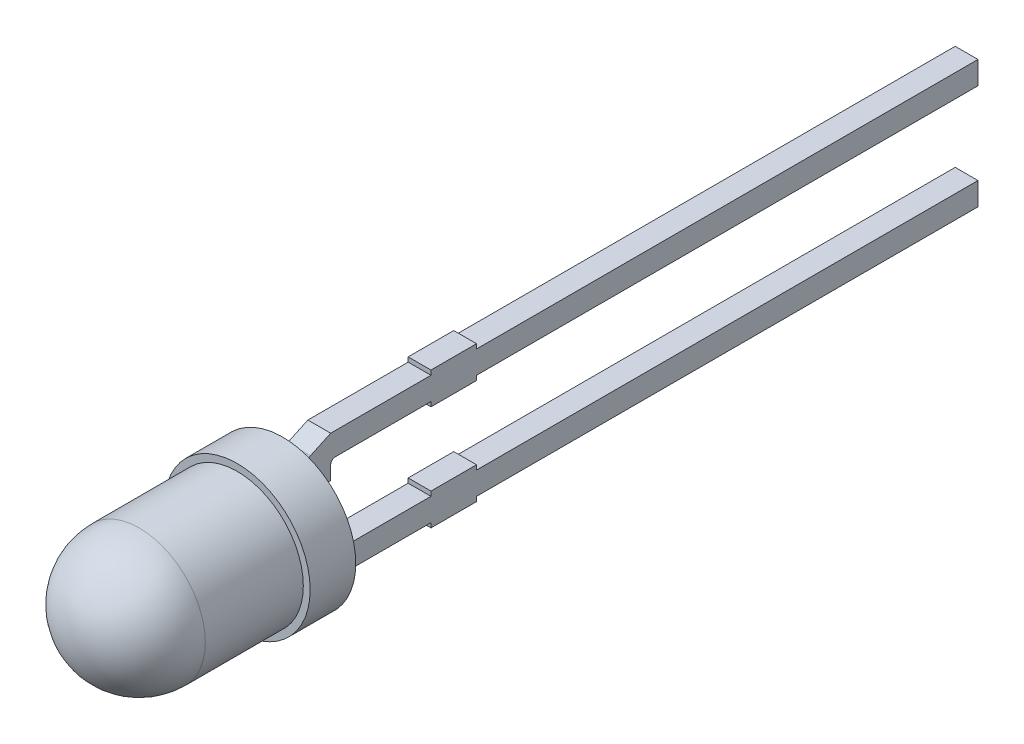
from build123d import *

# Parameters (mm, degrees)
EXTRUDE1_DEPTH          = 0.25
FILLET1_R               = 0.25
CUT_EXTRUDE1_DEPTH      = 31.234789562
CUT_EXTRUDE1_DEPTH_BACK = 31.234789562
SKETCH3_W               = 12
SKETCH3_H               = 2.8


with BuildPart() as part:
    # Sketch1 → Revolve1 (revolve)
    with BuildSketch(Plane(origin=(0, 0, 0), x_dir=(0, 0, -1), z_dir=(1, 0, 0)), mode=Mode.PRIVATE) as revolve1_sk:
        with BuildLine():
            Line((0, 1.45), (2.15, 1.45))
            Line((2.15, 1.45), (2.15, 1.599999975))
            Line((2.15, 1.599999975), (3.15, 1.599999975))
            Line((3.15, 1.599999975), (3.15, 0))
            Line((3.15, 0), (-1.45, 0))
            ThreePointArc((-1.45, 0), (-1.025304833, 1.025304833), (0, 1.45))
        make_face()
    revolve(revolve1_sk.sketch.rotate(Axis((0, 0, 0), (0, 0, -1)), 90), axis=Axis((0, 0, 0), (0, 0, -1)))

    # Sketch2 → Extrude1 (add, symmetric)
    with BuildSketch(Plane(origin=(0, 0, 0), x_dir=(0, 0, -1), z_dir=(1, 0, 0))):
        with BuildLine():
            Line((3.15, 1.026953873), (3.95, 1.4))
            Line((3.95, 1.4), (6.15, 1.4))
            Line((6.15, 1.4), (6.15, 1.5))
            Line((6.15, 1.5), (7.15, 1.5))
            Line((7.15, 1.5), (7.15, 1.4))
            Line((7.15, 1.4), (30.15, 1.4))
            Line((30.15, 1.4), (30.15, 0.9))
            Line((30.15, 0.9), (7.15, 0.9))
            Line((7.15, 0.9), (7.15, 0.8))
            Line((7.15, 0.8), (6.15, 0.8))
            Line((6.15, 0.8), (6.15, 0.9))
            Line((6.15, 0.9), (4.05, 0.9))
            ThreePointArc((4.05, 0.9), (3.979289322, 0.870710678), (3.95, 0.8))
            Line((3.95, 0.8), (3.95, 0.5))
            Line((3.95, 0.5), (3.15, 0.5))
            Line((3.15, 0.5), (3.15, 1.026953873))
        make_face()
        with BuildLine():
            Line((3.95, -0.8), (3.95, -0.5))
            Line((3.95, -0.5), (3.15, -0.5))
            Line((3.15, -0.5), (3.15, -1.026953873))
            Line((3.15, -1.026953873), (3.95, -1.4))
            Line((3.95, -1.4), (6.15, -1.4))
            Line((6.15, -1.4), (6.15, -1.5))
            Line((6.15, -1.5), (7.15, -1.5))
            Line((7.15, -1.5), (7.15, -1.4))
            Line((7.15, -1.4), (30.15, -1.4))
            Line((30.15, -1.4), (30.15, -0.9))
            Line((30.15, -0.9), (7.15, -0.9))
            Line((7.15, -0.9), (7.15, -0.8))
            Line((7.15, -0.8), (6.15, -0.8))
            Line((6.15, -0.8), (6.15, -0.9))
            Line((6.15, -0.9), (4.05, -0.9))
            ThreePointArc((4.05, -0.9), (3.979289322, -0.870710678), (3.95, -0.8))
        make_face()
    extrude(amount=EXTRUDE1_DEPTH, both=True)

    # Fillet1
    fillet1_edges = [part.edges().sort_by_distance(p)[0] for p in [
        (-0.25, 0.763476937, -3.15),
        (0, 1.026953873, -3.15),
        (0, 0.5, -3.15),
        (0.25, 0.763476937, -3.15),
        (-0.25, -0.763476937, -3.15),
        (0, -0.5, -3.15),
        (0, -1.026953873, -3.15),
        (0.25, -0.763476937, -3.15),
    ]]
    fillet(fillet1_edges, radius=FILLET1_R)

    # Sketch3 → Cut-Extrude1 (cut, two sides: drawn at the far end of the back side and taken through both)
    with BuildSketch(Plane(origin=(0, 0, 0), x_dir=(0, 0, -1), z_dir=(1, 0, 0)).offset(-CUT_EXTRUDE1_DEPTH_BACK)):
        with Locations((24.15, 0)):
            Rectangle(SKETCH3_W, SKETCH3_H)
    extrude(amount=CUT_EXTRUDE1_DEPTH + CUT_EXTRUDE1_DEPTH_BACK, mode=Mode.SUBTRACT)


solid = part.part
